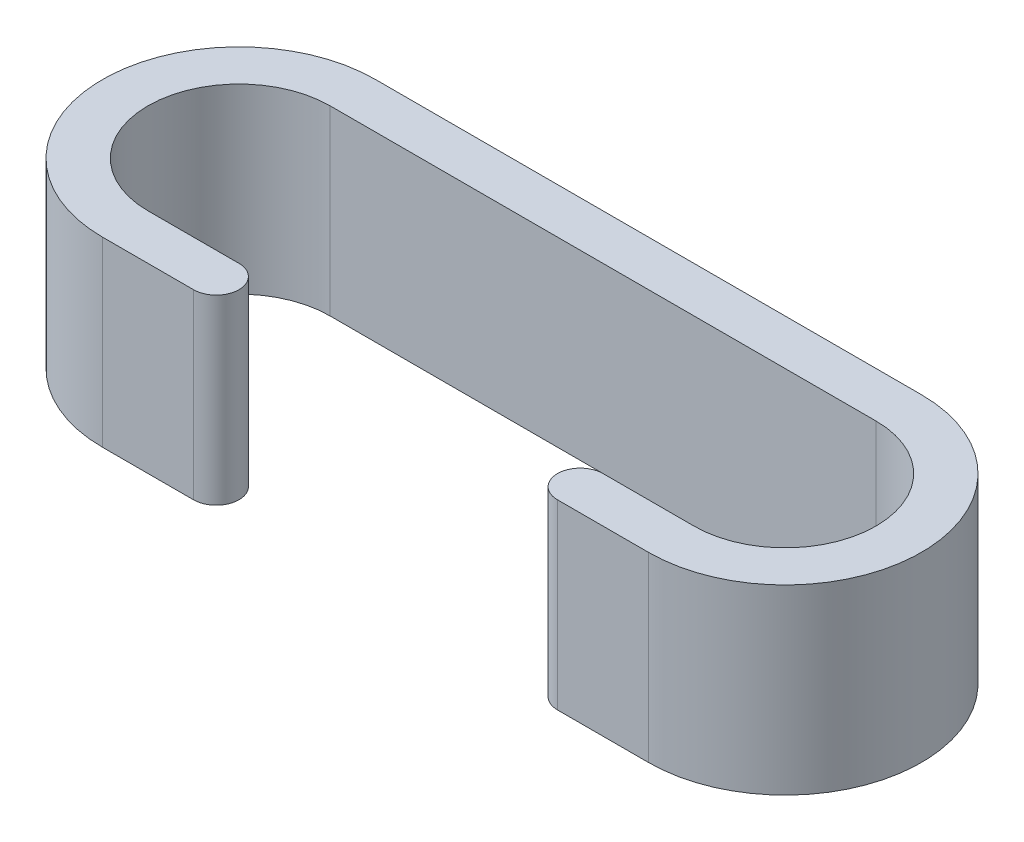
from build123d import *

# Parameters (mm, degrees)
BOSS_EXTRUDE1_DEPTH = 6.35


with BuildPart() as part:
    # Sketch1 → Boss-Extrude1 (new body)
    with BuildSketch(Plane(origin=(0, 0, 0), x_dir=(1, 0, 0), z_dir=(0, 1, 0))):
        with BuildLine():
            Line((-6.35, 0), (-9.525, 0))
            ThreePointArc((-9.525, 0), (-12.7, 3.175), (-9.525, 6.35))
            Line((-9.525, 6.35), (9.525, 6.35))
            ThreePointArc((9.525, 6.35), (12.7, 3.175), (9.525, 0))
            Line((9.525, 0), (6.35, 0))
            ThreePointArc((6.35, 0), (5.55625, -0.79375), (6.35, -1.5875))
            Line((6.35, -1.5875), (9.525, -1.5875))
            ThreePointArc((9.525, -1.5875), (14.2875, 3.175), (9.525, 7.9375))
            Line((9.525, 7.9375), (-9.525, 7.9375))
            ThreePointArc((-9.525, 7.9375), (-14.2875, 3.175), (-9.525, -1.5875))
            Line((-9.525, -1.5875), (-6.35, -1.5875))
            ThreePointArc((-6.35, -1.5875), (-5.55625, -0.79375), (-6.35, 0))
        make_face()
    extrude(amount=BOSS_EXTRUDE1_DEPTH)


solid = part.part
